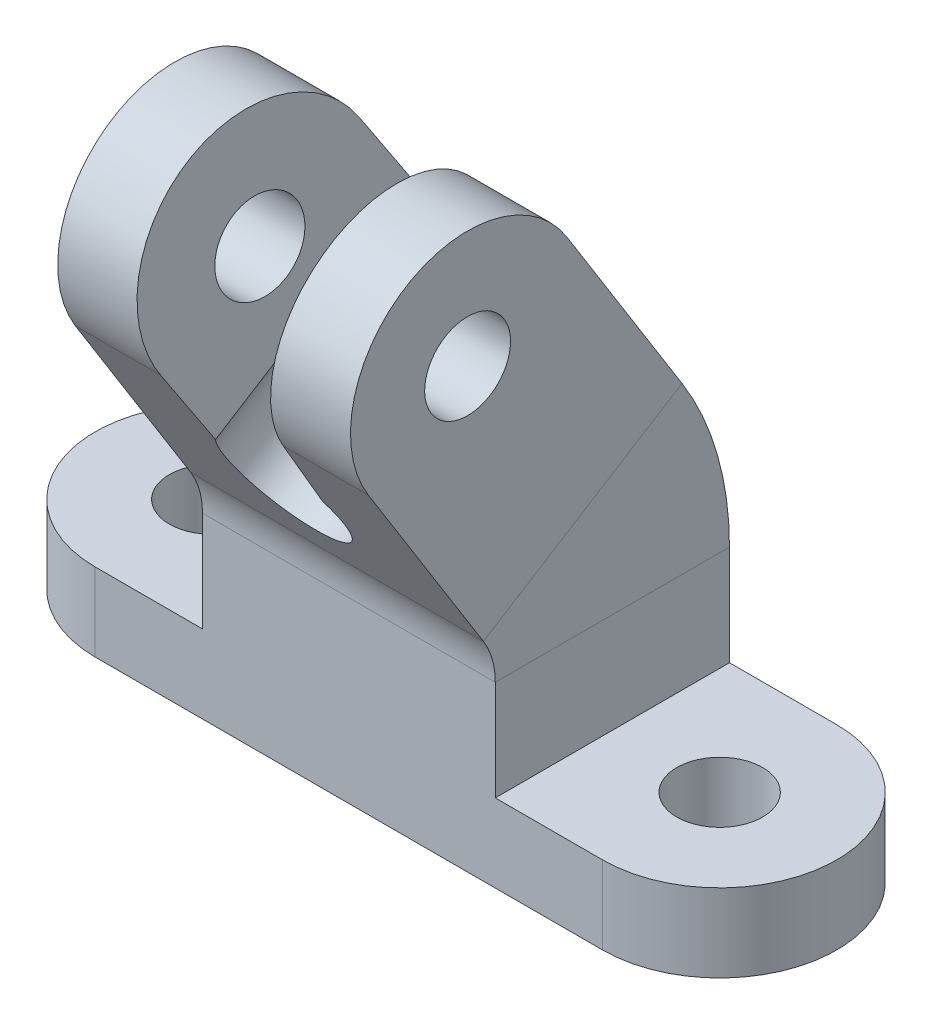
from build123d import *

# Parameters (mm, degrees)
EXTRUDE_1_DEPTH     = 2
SKETCH_7_R          = 1.1
CUT_EXTRUDE_5_DEPTH = 3.5
SKETCH_8_W          = 7.5
SKETCH_8_H          = 6
FILLET_1_RADIUS     = 3
FILLET_1_LENGTH     = 7.5
CUT_EXTRUDE_6_DEPTH = 10
SKETCH_12_R         = 1.1
CUT_EXTRUDE_7_DEPTH = 10


with BuildPart() as part:
    # 草图1 → 凸台-拉伸1 (new body)
    with BuildSketch(Plane(origin=(0, 0, 0), x_dir=(1, 0, 0), z_dir=(0, 1, 0))):
        with BuildLine():
            Line((-6.5, 3), (6.5, 3))
            ThreePointArc((6.5, 3), (9.5, 0), (6.5, -3))
            Line((6.5, -3), (-6.5, -3))
            ThreePointArc((-6.5, -3), (-9.5, 0), (-6.5, 3))
        make_face()
    extrude(amount=EXTRUDE_1_DEPTH)

    # 草图7 → 切除-拉伸5 (cut)
    with BuildSketch(Plane(origin=(0, 2, 0), x_dir=(1, 0, 0), z_dir=(0, 1, 0))):
        with Locations(Location((6.5, 0, 0), (0, 0, 270))):
            Circle(SKETCH_7_R)
        with Locations(Location((-6.5, 0, 0), (0, 0, 270))):
            Circle(SKETCH_7_R)
    extrude(amount=-CUT_EXTRUDE_5_DEPTH, mode=Mode.SUBTRACT)

    # 扫描1: sweep along a path in 草图9
    with BuildLine(Plane(origin=(0, 0, 0), x_dir=(0, 0, -1), z_dir=(1, 0, 0))) as sweep_1_path:
        Line((0, 2), (0, 4.566273071))
        ThreePointArc((0, 4.566273071), (-0.19369152, 5.94445985), (-0.759759519, 7.215869392))
        Line((-0.759759519, 7.215869392), (-5.299192642, 14.480480962))
    # 草图8 → 扫描1 (sweep)
    with BuildSketch(Plane(origin=(0, 2, 0), x_dir=(1, 0, 0), z_dir=(0, 1, 0))):
        Rectangle(SKETCH_8_W, SKETCH_8_H)
    sweep(path=sweep_1_path.line)

    # 圆角1: full round fillet: the end face becomes a half cylinder, R = half its width
    fillet_1_face = Plane((0, 14.480480962, 5.299192642), x_dir=(1, 0, 0), z_dir=(0, 0.848048096156, 0.529919264233))  # on the end face: x along it, z out of the body
    fillet_1_slab = fillet_1_face.offset(-FILLET_1_RADIUS / 2) * Box(FILLET_1_LENGTH, 2 * FILLET_1_RADIUS, FILLET_1_RADIUS, mode=Mode.PRIVATE)  # the body's end, R deep
    fillet_1_round = Plane((0, 11.936336674, 3.709434849), x_dir=(0, 0.848048096156, 0.529919264233), z_dir=(1, 0, 0)) * Cylinder(FILLET_1_RADIUS, FILLET_1_LENGTH, mode=Mode.PRIVATE)  # its axis R under the face
    add(fillet_1_slab - fillet_1_round, mode=Mode.SUBTRACT)

    # 草图10 → 切除-拉伸6 (cut)
    with BuildSketch(Plane(origin=(0, 0.095128767, -0.15223785), x_dir=(1, 0, 0), z_dir=(0, -0.5299192642332061, 0.8480480961564253))):
        with BuildLine():
            Line((1.372390297, 9.808736266), (2.069809275, 17.780271657))
            Line((2.069809275, 17.780271657), (-2.069809275, 17.780271657))
            Line((-2.069809275, 17.780271657), (-1.372390297, 9.808736266))
            ThreePointArc((-1.372390297, 9.808736266), (0, 7.538288577), (1.372390297, 9.808736266))
        make_face()
    extrude(amount=-CUT_EXTRUDE_6_DEPTH, mode=Mode.SUBTRACT)

    # 草图12 → 切除-拉伸7 (cut)
    with BuildSketch(Plane.ZY.offset(3.75)):
        with Locations((3.70943485, 11.936336673)):
            Circle(SKETCH_12_R)
    extrude(amount=-CUT_EXTRUDE_7_DEPTH, mode=Mode.SUBTRACT)


solid = part.part
